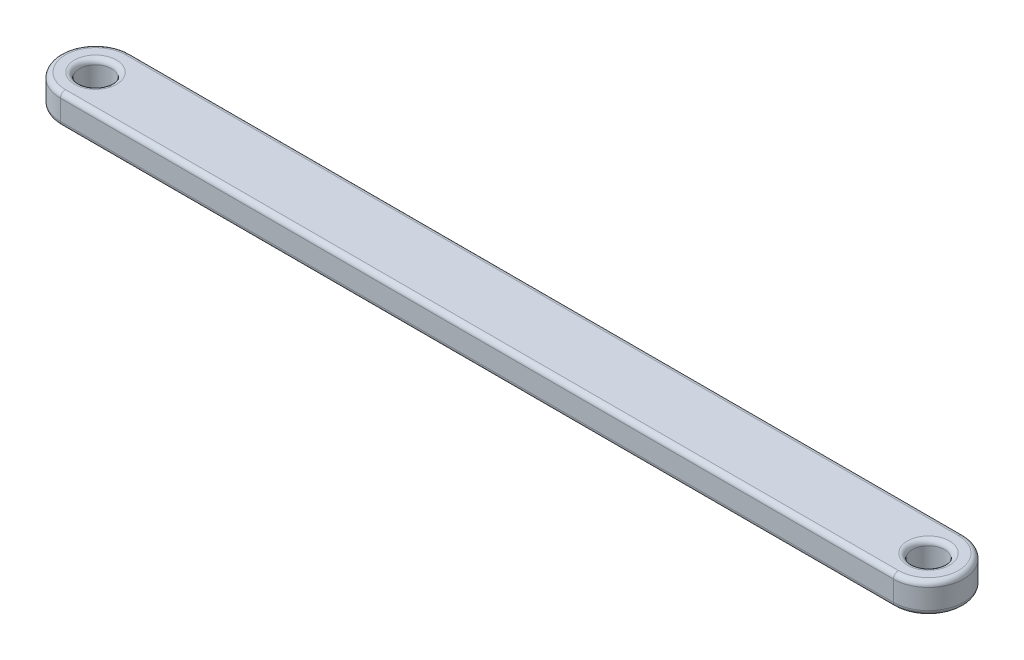
from build123d import *

# Parameters (mm, degrees)
SKETCH1_R           = 1.6
BOSS_EXTRUDE1_DEPTH = 3
FILLET1_R           = 0.5


with BuildPart() as part:
    # Sketch1 → Boss-Extrude1 (new body)
    with BuildSketch(Plane(origin=(0, 0, 0), x_dir=(1, 0, 0), z_dir=(0, 1, 0))):
        with BuildLine():
            Line((-41.55, 3.5), (41.55, 3.5))
            ThreePointArc((41.55, 3.5), (45.05, 0), (41.55, -3.5))
            Line((41.55, -3.5), (-41.55, -3.5))
            ThreePointArc((-41.55, -3.5), (-45.05, 0), (-41.55, 3.5))
        make_face()
        with Locations(Location((41.55, 0, 0), (0, 0, 270))):
            Circle(SKETCH1_R, mode=Mode.SUBTRACT)
        with Locations(Location((-41.55, 0, 0), (0, 0, 270))):
            Circle(SKETCH1_R, mode=Mode.SUBTRACT)
    extrude(amount=BOSS_EXTRUDE1_DEPTH)

    # Fillet1
    fillet1_edges = [part.edges().sort_by_distance(p)[0] for p in [
        (41.55, 0, -1.6),
        (41.55, 3, -1.6),
        (45.05, 3, 0),
        (-41.55, 0, -1.6),
        (-41.55, 3, -1.6),
        (0, 3, -3.5),
        (-45.05, 3, 0),
        (0, 0, -3.5),
        (45.05, 0, 0),
        (0, 0, 3.5),
        (-45.05, 0, 0),
        (0, 3, 3.5),
    ]]
    fillet(fillet1_edges, radius=FILLET1_R)


solid = part.part
